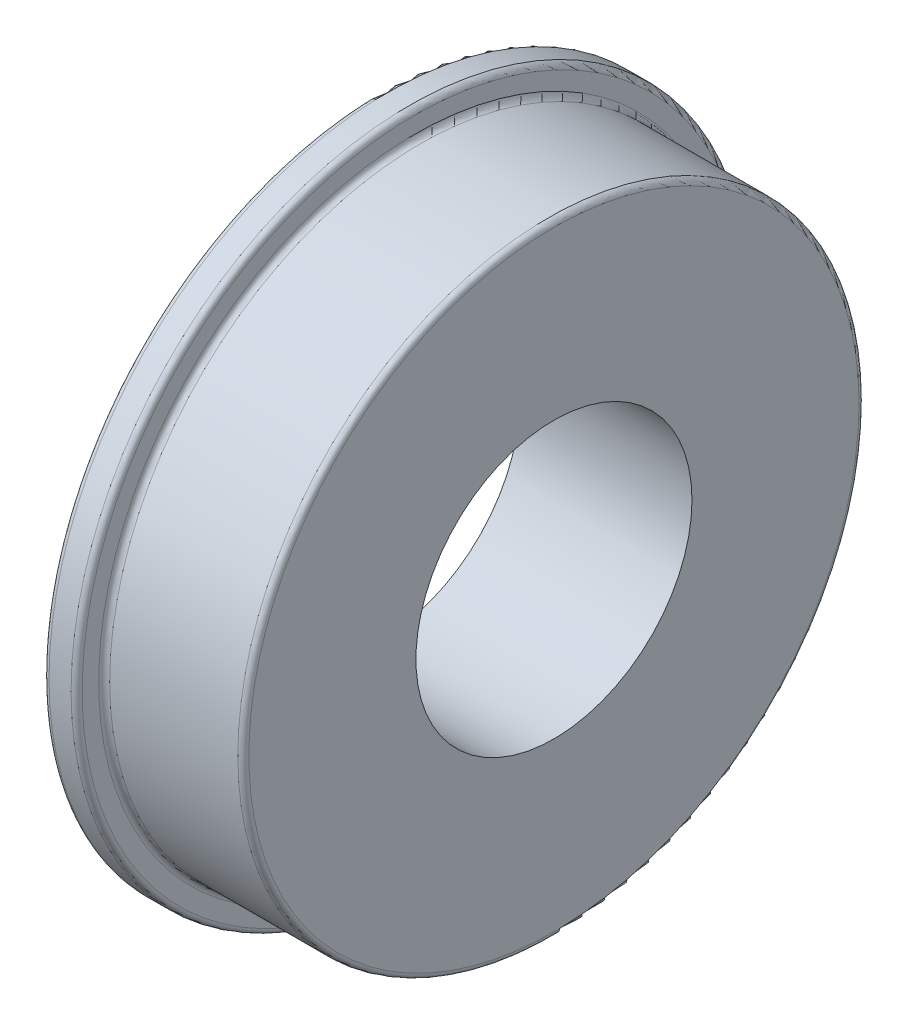
from build123d import *

# Parameters (mm, degrees)
SKETCH1_R           = 15.5575
BOSS_EXTRUDE1_DEPTH = 1.524
SKETCH2_R           = 14.2875
BOSS_EXTRUDE2_DEPTH = 6.4008
SKETCH3_R           = 6.35
CUT_EXTRUDE1_DEPTH  = 24.38533873
FILLET1_R           = 0.254


with BuildPart() as part:
    # Sketch1 → Boss-Extrude1 (new body)
    with BuildSketch(Plane(origin=(0, 0, 0), x_dir=(0, 0, -1), z_dir=(1, 0, 0))):
        with Locations(Location((0, 0, 0), (0, 0, 180))):
            Circle(SKETCH1_R)
    extrude(amount=BOSS_EXTRUDE1_DEPTH)

    # Sketch2 → Boss-Extrude2 (add)
    with BuildSketch(Plane(origin=(1.524, 0, 0), x_dir=(0, 0, -1), z_dir=(1, 0, 0))):
        Circle(SKETCH2_R)
    extrude(amount=BOSS_EXTRUDE2_DEPTH)

    # Sketch3 → Cut-Extrude1 (cut, through all)
    with BuildSketch(Plane(origin=(7.9248, 0, 0), x_dir=(0, 0, -1), z_dir=(1, 0, 0))):
        Circle(SKETCH3_R)
    extrude(amount=-CUT_EXTRUDE1_DEPTH, mode=Mode.SUBTRACT)

    # Fillet1
    fillet1_edges = [part.edges().sort_by_distance(p)[0] for p in [
        (0, 0, -15.5575),
        (1.524, 0, -15.5575),
        (1.524, 0, 14.2875),
        (7.9248, 0, 14.2875),
    ]]
    fillet(fillet1_edges, radius=FILLET1_R)


solid = part.part
